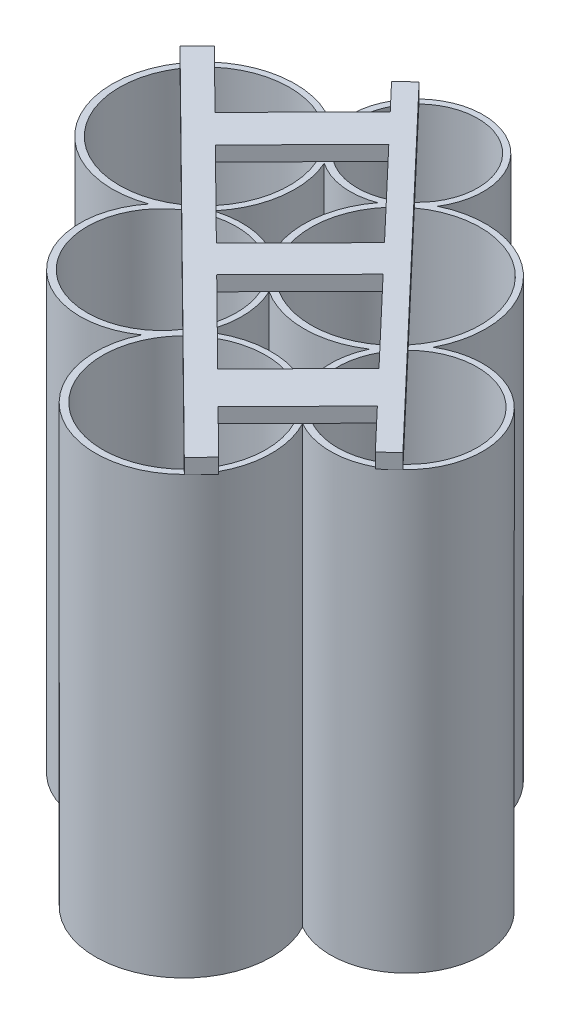
from build123d import *

# Parameters (mm, degrees)
SKETCH1_R           = 12.3
SKETCH1_R_2         = 11.9
SKETCH1_R_3         = 10.3
SKETCH1_R_4         = 10.95
SKETCH1_R_5         = 12.35
SKETCH1_R_6         = 9
BOSS_EXTRUDE4_DEPTH = 59
SKETCH4_R           = 8.15
SKETCH4_R_2         = 11.5
SKETCH4_R_3         = 10.1
SKETCH4_R_4         = 11.45
SKETCH4_R_5         = 9.45
SKETCH4_R_6         = 11.05
CUT_EXTRUDE2_DEPTH  = 57
BOSS_EXTRUDE5_DEPTH = 2


with BuildPart() as part:
    # Sketch1 → Boss-Extrude4 (new body)
    with BuildSketch(Plane(origin=(0, 0, 0), x_dir=(1, 0, 0), z_dir=(0, 1, 0))):
        with Locations((35.512781465, 27.639016147)):
            Circle(SKETCH1_R)
        with Locations((36.005267937, -1.447561772)):
            Circle(SKETCH1_R_2)
        with Locations((51.661033243, 13.068619292)):
            Circle(SKETCH1_R_3)
        with Locations((18.919707674, 12.591428229)):
            Circle(SKETCH1_R_4)
        with Locations((6.200754384, 31.090907335)):
            Circle(SKETCH1_R_5)
        with Locations((22.571970647, 43.529254056)):
            Circle(SKETCH1_R_6)
    extrude(amount=BOSS_EXTRUDE4_DEPTH)

    # Sketch4 → Cut-Extrude2 (cut)
    with BuildSketch(Plane(origin=(0, 59, 0), x_dir=(1, 0, 0), z_dir=(0, 1, 0))):
        with Locations(Location((22.611280457, 43.589861599, 0), (0, 0, 270))):
            Circle(SKETCH4_R)
        with Locations(Location((6.240064194, 31.151514878, 0), (0, 0, 270))):
            Circle(SKETCH4_R_2)
        with Locations(Location((18.959017484, 12.652035772, 0), (0, 0, 270))):
            Circle(SKETCH4_R_3)
        with Locations(Location((35.552091275, 27.69962369, 0), (0, 0, 270))):
            Circle(SKETCH4_R_4)
        with Locations(Location((51.700343053, 13.129226835, 0), (0, 0, 270))):
            Circle(SKETCH4_R_5)
        with Locations(Location((36.044577747, -1.386954229, 0), (0, 0, 270))):
            Circle(SKETCH4_R_6)
    extrude(amount=-CUT_EXTRUDE2_DEPTH, mode=Mode.SUBTRACT)

    # Sketch5 → Boss-Extrude5 (add)
    with BuildSketch(Plane(origin=(0, 59, 0), x_dir=(1, 0, 0), z_dir=(0, 1, 0))):
        Polygon((40.81243907, -1.58402798), (51.520532369, 9.252965923), (56.778337624, 3.7224031), (58.688878923, 5.538719884), (16.370888419, 50.052027945), (14.460347121, 48.235711161), (17.926333207, 44.589921166), (6.147145479, 32.668939341), (-1.681518051, 40.404484846), (-3.988115938, 38.070120871), (44.470030089, -9.811639827), (46.776627976, -7.477275852), align=None)
        Polygon((36.463308943, 25.091308361), (47.227733247, 13.768461283), (36.382771282, 2.792951133), (25.275141449, 13.768461283), align=None, mode=Mode.SUBTRACT)
        Polygon((21.642995472, 40.680450739), (32.86204414, 28.879394887), (21.559056386, 17.440345379), (9.982307257, 28.879394887), align=None, mode=Mode.SUBTRACT)
    extrude(amount=BOSS_EXTRUDE5_DEPTH)


solid = part.part
